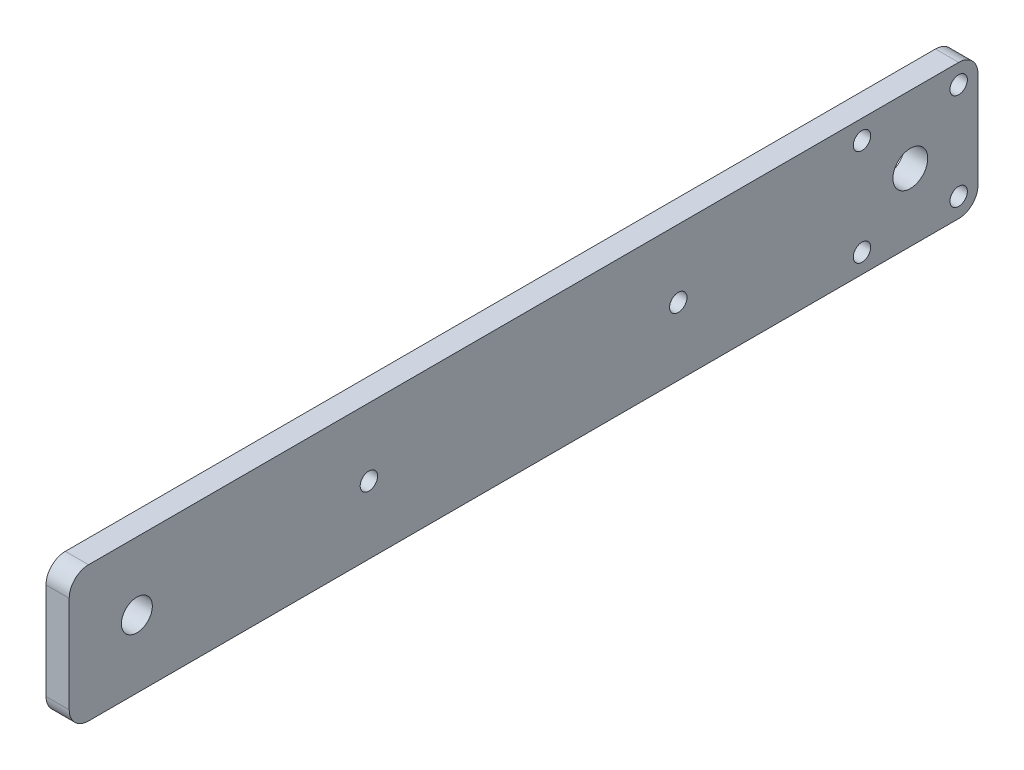
from build123d import *

# Parameters (mm, degrees)
CROQUIS2_W                   = 235
CROQUIS2_H                   = 35
CROQUIS2_R                   = 4
CROQUIS2_R_2                 = 4.5
SALIENTE_EXTRUIR1_DEPTH      = 3
REDONDEO1_R                  = 5
TALADRO_DE_MARGEN_PARA_M41_D = 4.5
TALADRO_DE_MARGEN_PARA_M42_D = 4.5


with BuildPart() as part:
    # Croquis2 → Saliente-Extruir1 (new, symmetric)
    with BuildSketch(Plane(origin=(0, 0, 0), x_dir=(0, 0, -1), z_dir=(1, 0, 0))):
        Rectangle(CROQUIS2_W, CROQUIS2_H)
        with Locations((-100, 0)):
            Circle(CROQUIS2_R, mode=Mode.SUBTRACT)
        with Locations((100, 0)):
            Circle(CROQUIS2_R_2, mode=Mode.SUBTRACT)
    extrude(amount=SALIENTE_EXTRUIR1_DEPTH, both=True)

    # Redondeo1
    redondeo1_edges = [part.edges().sort_by_distance(p)[0] for p in [
        (0, 17.5, 117.5),
        (0, 17.5, -117.5),
        (0, -17.5, -117.5),
        (0, -17.5, 117.5),
    ]]
    fillet(redondeo1_edges, radius=REDONDEO1_R)

    # Taladro de margen para M41 (through all)
    with Locations(Plane(origin=(3, 0, 0), x_dir=(0, 0, -1), z_dir=(1, 0, 0))):
        with Locations((112.5, 12.5), (87.5, 12.5), (87.5, -12.5), (112.5, -12.5)):
            Hole(TALADRO_DE_MARGEN_PARA_M41_D / 2)

    # Taladro de margen para M42 (through all)
    with Locations(Plane(origin=(3, 0, 0), x_dir=(0, 0, -1), z_dir=(1, 0, 0))):
        with Locations((-40, 0), (40, 0)):
            Hole(TALADRO_DE_MARGEN_PARA_M42_D / 2)


solid = part.part
